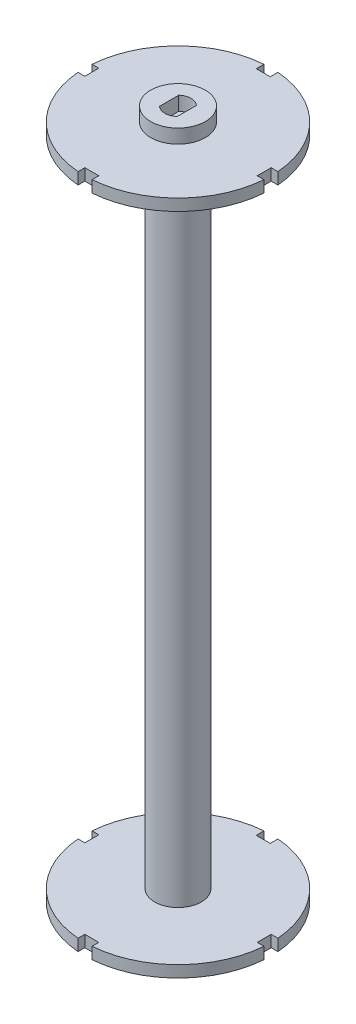
from build123d import *

# Parameters (mm, degrees)
SKETCH1_R           = 5.85
BOSS_EXTRUDE1_DEPTH = 5.5
SKETCH2_R           = 20
BOSS_EXTRUDE2_DEPTH = 2.5
CUT_EXTRUDE1_DEPTH  = 8
SKETCH4_W           = 3
SKETCH4_H           = 3
CUT_EXTRUDE2_DEPTH  = 10
SKETCH5_R           = 5
BOSS_EXTRUDE3_DEPTH = 140


with BuildPart() as part:
    # Sketch1 → Boss-Extrude1 (new body)
    with BuildSketch(Plane(origin=(0, 0, 0), x_dir=(1, 0, 0), z_dir=(0, 1, 0))):
        Circle(SKETCH1_R)
        with BuildLine():
            Line((1.9, 2.05669638), (1.9, -2.05669638))
            ThreePointArc((1.9, -2.05669638), (0, -2.8), (-1.9, -2.05669638))
            Line((-1.9, -2.05669638), (-1.9, 2.05669638))
            ThreePointArc((-1.9, 2.05669638), (0, 2.8), (1.9, 2.05669638))
        make_face(mode=Mode.SUBTRACT)
    boss_extrude1 = extrude(amount=BOSS_EXTRUDE1_DEPTH)

    # Sketch2 → Boss-Extrude2 (add)
    with BuildSketch(Plane(origin=(0, 5.5, 0), x_dir=(1, 0, 0), z_dir=(0, 1, 0))):
        Circle(SKETCH2_R)
    boss_extrude2 = extrude(amount=-BOSS_EXTRUDE2_DEPTH)

    # Sketch3 → Cut-Extrude1 (cut)
    with BuildSketch(Plane.XZ.offset(-3)):
        with BuildLine():
            Line((-1.9, 2.05669638), (-1.9, -2.05669638))
            ThreePointArc((-1.9, -2.05669638), (0, -2.8), (1.9, -2.05669638))
            Line((1.9, -2.05669638), (1.9, 2.05669638))
            ThreePointArc((1.9, 2.05669638), (0, 2.8), (-1.9, 2.05669638))
        make_face()
    extrude(amount=-CUT_EXTRUDE1_DEPTH, mode=Mode.SUBTRACT)

    # Sketch4 → Cut-Extrude2 (cut)
    with BuildSketch(Plane(origin=(0, 5.5, 0), x_dir=(1, 0, 0), z_dir=(0, 1, 0))):
        with Locations((0, 19.8)):
            Rectangle(SKETCH4_W, SKETCH4_H)
        with Locations((20, 0)):
            Rectangle(SKETCH4_W, SKETCH4_H)
        with Locations((0, -20)):
            Rectangle(SKETCH4_W, SKETCH4_H)
        with Locations((-20, 0)):
            Rectangle(SKETCH4_W, SKETCH4_H)
    cut_extrude2 = extrude(amount=-CUT_EXTRUDE2_DEPTH, mode=Mode.SUBTRACT)

    # Sketch5 → Boss-Extrude3 (add)
    with BuildSketch(Plane(origin=(0, 5.5, 0), x_dir=(1, 0, 0), z_dir=(0, 1, 0))):
        Circle(SKETCH5_R)
    extrude(amount=BOSS_EXTRUDE3_DEPTH)

    # Mirror1: Boss-Extrude2 across plane
    add(boss_extrude2.mirror(Plane.ZX.offset(75.5)))

    # Mirror2: Boss-Extrude1, Cut-Extrude2 across plane
    add(boss_extrude1.mirror(Plane.ZX.offset(75.5)))
    add(cut_extrude2.mirror(Plane.ZX.offset(75.5)), mode=Mode.SUBTRACT)


solid = part.part
